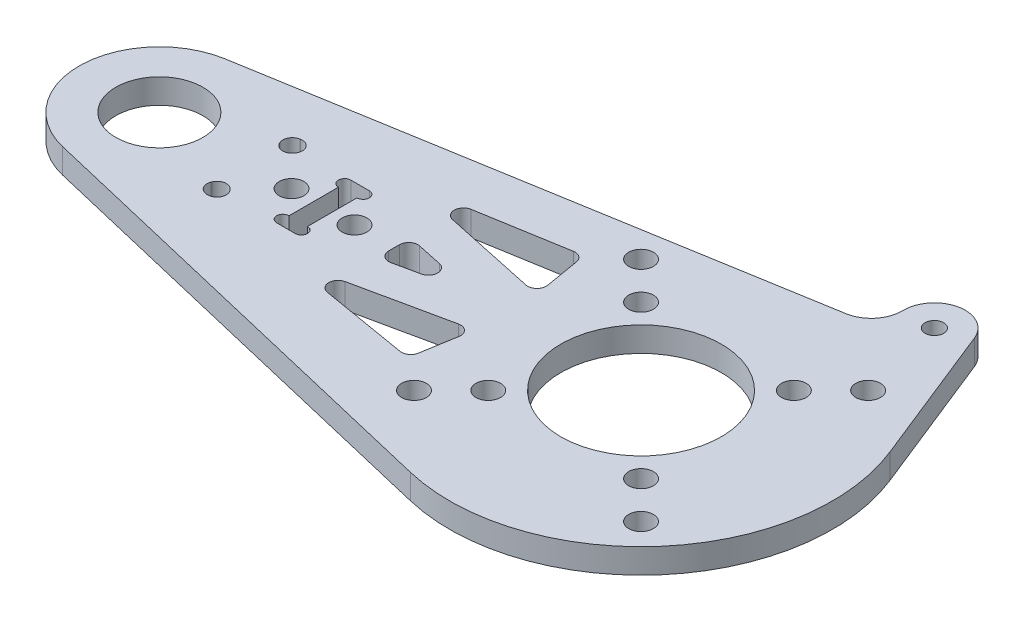
from build123d import *

# Parameters (mm, degrees)
SKETCH_1_R          = 7.05
SKETCH_1_R_2        = 1.5
SKETCH_1_R_3        = 2
SKETCH_1_R_4        = 13
EXTRUDE_1_DEPTH     = 4
SKETCH_4_R          = 2
SKETCH_4_W          = 3
SKETCH_4_H          = 12
CUT_EXTRUDE_7_DEPTH = 99.505076011
SKETCH_8_R          = 1
CUT_EXTRUDE_6_DEPTH = 99.505076011
CUT_EXTRUDE_8_DEPTH = 99.505076011
FILLET_1_R          = 1.5


with BuildPart() as part:
    # 草图1 → 凸台-拉伸1 (new body)
    with BuildSketch(Plane(origin=(0, 0, 0), x_dir=(1, 0, 0), z_dir=(0, 1, 0))):
        with BuildLine():
            Line((-80.166666667, 12.818172863), (5.835638785, 27.355215737))
            ThreePointArc((5.835638785, 27.355215737), (8.855550352, 29.098982843), (10.001152726, 32.392641112))
            ThreePointArc((10.001152726, 32.392641112), (14.001538866, 37.399293353), (19.642183216, 34.3574539))
            Line((19.642183216, 34.3574539), (28.781535937, 11.516214183))
            ThreePointArc((28.781535937, 11.516214183), (23.478372246, -20.242678595), (-7.153846154, -30.163263835))
            Line((-7.153846154, -30.163263835), (-81, -12.649110641))
            ThreePointArc((-81, -12.649110641), (-90.993045962, 0.425154819), (-80.166666667, 12.818172863))
        make_face()
        with Locations(Location((-78, 0, 0), (0, 0, 270))):
            Circle(SKETCH_1_R, mode=Mode.SUBTRACT)
        with Locations(Location((15, 32.5, 0), (0, 0, 270))):
            Circle(SKETCH_1_R_2, mode=Mode.SUBTRACT)
        with Locations(Location((-18.384776311, 18.384776311, 0), (0, 0, 270))):
            Circle(SKETCH_1_R_3, mode=Mode.SUBTRACT)
        with Locations(Location((18.384776311, 18.384776311, 0), (0, 0, 270))):
            Circle(SKETCH_1_R_3, mode=Mode.SUBTRACT)
        with Locations(Location((18.384776311, -18.384776311, 0), (0, 0, 270))):
            Circle(SKETCH_1_R_3, mode=Mode.SUBTRACT)
        with Locations(Location((-18.384776311, -18.384776311, 0), (0, 0, 270))):
            Circle(SKETCH_1_R_3, mode=Mode.SUBTRACT)
        with Locations(Location((-12.374368671, 12.374368671, 0), (0, 0, 270))):
            Circle(SKETCH_1_R_3, mode=Mode.SUBTRACT)
        with Locations(Location((12.374368671, 12.374368671, 0), (0, 0, 270))):
            Circle(SKETCH_1_R_3, mode=Mode.SUBTRACT)
        with Locations(Location((12.374368671, -12.374368671, 0), (0, 0, 270))):
            Circle(SKETCH_1_R_3, mode=Mode.SUBTRACT)
        with Locations(Location((-12.374368671, -12.374368671, 0), (0, 0, 270))):
            Circle(SKETCH_1_R_3, mode=Mode.SUBTRACT)
        with Locations(Location((0, 0, 0), (0, 0, 270))):
            Circle(SKETCH_1_R_4, mode=Mode.SUBTRACT)
    extrude(amount=EXTRUDE_1_DEPTH)

    # 草图4 → 切除-拉伸7 (cut, through all)
    with BuildSketch(Plane(origin=(0, 4, 0), x_dir=(1, 0, 0), z_dir=(0, 1, 0))):
        with Locations(Location((-56.6, 0, 0), (0, 0, 270))):
            Circle(SKETCH_4_R)
        with Locations(Location((-46.4, 0, 0), (0, 0, 270))):
            Circle(SKETCH_4_R)
        with Locations((-51.5, 0)):
            Rectangle(SKETCH_4_W, SKETCH_4_H)
    extrude(amount=-CUT_EXTRUDE_7_DEPTH, mode=Mode.SUBTRACT)

    # 草图8 → 切除-拉伸6 (cut, through all)
    with BuildSketch(Plane(origin=(0, 4, 0), x_dir=(1, 0, 0), z_dir=(0, 1, 0))):
        with Locations((-53, 5)):
            Circle(SKETCH_8_R)
        with Locations((-53, -5)):
            Circle(SKETCH_8_R)
        with Locations((-50, -5)):
            Circle(SKETCH_8_R)
        with Locations((-50, 5)):
            Circle(SKETCH_8_R)
    extrude(amount=-CUT_EXTRUDE_6_DEPTH, mode=Mode.SUBTRACT)

    # 草图9 → 切除-拉伸8 (cut, through all)
    with BuildSketch(Plane(origin=(0, 4, 0), x_dir=(1, 0, 0), z_dir=(0, 1, 0))):
        Polygon((-23.506360694, 14.282031751), (-21.937410968, 5), (-46.887877974, 10.329833989), align=None)
        Polygon((-46.887877974, -10.329833989), (-23.506360694, -14.282031751), (-21.937410968, -5), align=None)
        with BuildLine():
            Line((-64.836719159, 7.29592609), (-58.661742218, 8.339687697))
            Line((-58.661742218, 8.339687697), (-63.252034039, 3))
            ThreePointArc((-63.252034039, 3), (-63.880043564, 5.208582364), (-64.836719159, 7.29592609))
        make_face()
        with BuildLine():
            Line((-58.661742218, -8.339687697), (-63.252034039, -3))
            ThreePointArc((-63.252034039, -3), (-63.880043564, -5.208582364), (-64.836719159, -7.29592609))
            Line((-64.836719159, -7.29592609), (-58.661742218, -8.339687697))
        make_face()
        Polygon((-40, 2.723099806), (-27.252396227, 0), (-40, -2.723099806), align=None)
    extrude(amount=-CUT_EXTRUDE_8_DEPTH, mode=Mode.SUBTRACT)

    # 圆角1
    fillet_1_edges = [part.edges().sort_by_distance(p)[0] for p in [
        (-46.887877974, 2, 10.329833989),
        (-21.937410968, 2, 5),
        (-23.506360694, 2, 14.282031751),
        (-63.252034039, 2, -3),
        (-64.836719159, 2, -7.29592609),
        (-58.661742218, 2, -8.339687697),
        (-40, 2, 2.723099806),
        (-40, 2, -2.723099806),
        (-27.252396227, 2, 0),
        (-64.836719159, 2, 7.29592609),
        (-63.252034039, 2, 3),
        (-58.661742218, 2, 8.339687697),
        (-46.887877974, 2, -10.329833989),
        (-23.506360694, 2, -14.282031751),
        (-21.937410968, 2, -5),
    ]]
    fillet(fillet_1_edges, radius=FILLET_1_R)


solid = part.part
